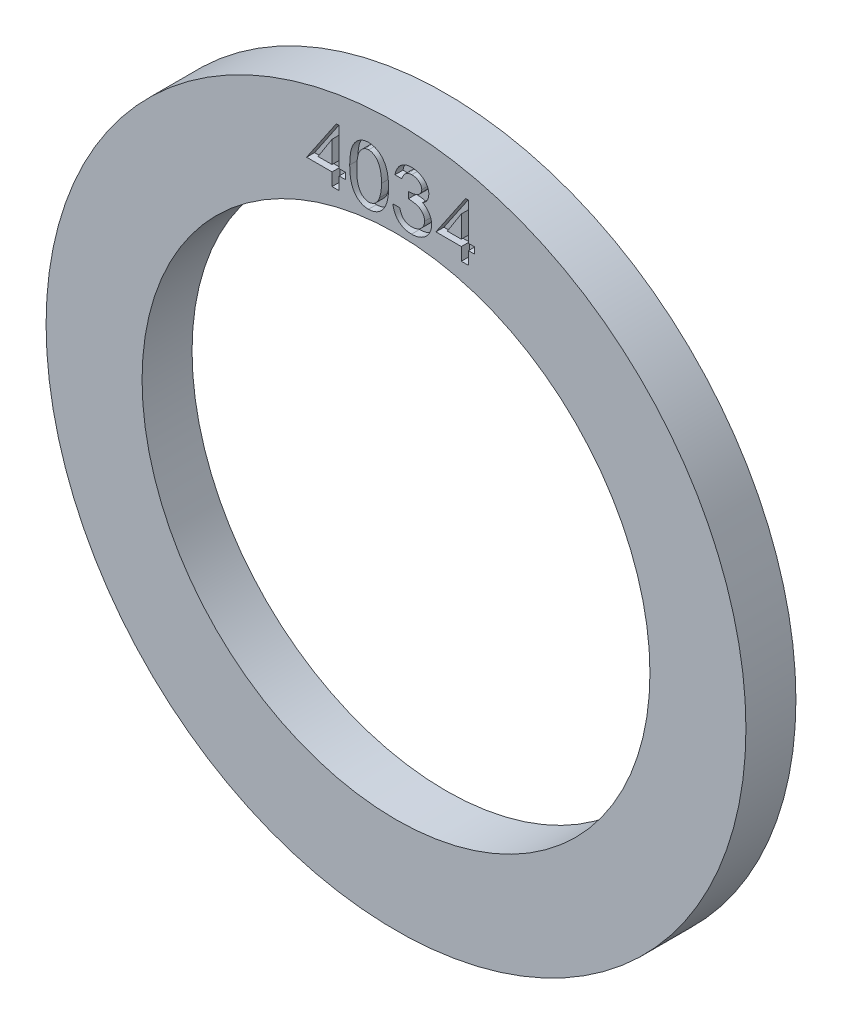
from build123d import *

# Parameters (mm, degrees)
SKETCH1_R           = 22.225
SKETCH1_R_2         = 16.129
BOSS_EXTRUDE1_DEPTH = 1.5875
CUT_EXTRUDE2_DEPTH  = 0.508


with BuildPart() as part:
    # Sketch1 → Boss-Extrude1 (new, symmetric)
    with BuildSketch(Plane.XY):
        Circle(SKETCH1_R)
        Circle(SKETCH1_R_2, mode=Mode.SUBTRACT)
    extrude(amount=BOSS_EXTRUDE1_DEPTH, both=True)

    # Sketch2 → Cut-Extrude2 (cut)
    # profile 1 of 4: a face of its own
    with BuildSketch(Plane.XY.offset(1.5875)):
        Polygon((-3.791509666, 20.251044915), (-3.614125852, 20.251044915), (-3.614125852, 17.872839787), (-3.210279698, 17.872839787), (-3.210279698, 17.468993633), (-3.614125852, 17.468993633), (-3.614125852, 16.661301325), (-4.0628438, 16.661301325), (-4.0628438, 17.468993633), (-5.678228416, 17.468993633), align=None)
        Polygon((-4.0628438, 17.872839787), (-4.0628438, 19.26456655), (-4.953969602, 17.872839787), align=None, mode=Mode.SUBTRACT)
    # profile 2 of 4: a face of its own
    with BuildSketch(Plane.XY.offset(1.5875)):
        with BuildLine():
            add(Edge.make_bspline(
                [(-2.941048928, 18.409899082), (-2.940714871, 18.465528296), (-2.940066118, 18.573562402), (-2.933075517, 18.730724356), (-2.921016214, 18.878244445), (-2.905526463, 19.016127046), (-2.884096804, 19.144466894), (-2.859576835, 19.263327408), (-2.829393503, 19.372723211), (-2.794138338, 19.472849511), (-2.754553878, 19.565484583), (-2.711030575, 19.651788768), (-2.663844085, 19.732857811), (-2.613313101, 19.808663476), (-2.55704867, 19.87751692), (-2.498353896, 19.941776173), (-2.435024929, 20.000186845), (-2.367642121, 20.052456508), (-2.297938231, 20.099713281), (-2.225089059, 20.13954444), (-2.150782552, 20.174241174), (-2.074071135, 20.202307821), (-1.995511001, 20.224110255), (-1.914820801, 20.239336109), (-1.832384226, 20.249821282), (-1.776518496, 20.250635629), (-1.748440755, 20.251044915)],
                knots=[0, 0, 0, 0, 1.622528522, 3.151013738, 4.587225782, 5.939257941, 7.196658267, 8.381214254, 9.47772444, 10.503964975, 11.475138444, 12.414102326, 13.321377868, 14.209997518, 15.068075989, 15.912287155, 16.746865696, 17.577313739, 18.397854368, 19.200328723, 19.996378645, 20.787862277, 21.580050128, 22.371504404, 23.181529048, 24, 24, 24, 24], degree=3))
            add(Edge.make_bspline(
                [(-1.748440755, 20.251044915), (-1.717811007, 20.250238313), (-1.657353324, 20.248646222), (-1.567631206, 20.239981971), (-1.480917261, 20.222477299), (-1.396021734, 20.20052576), (-1.314319719, 20.170517531), (-1.234192802, 20.136009443), (-1.158107244, 20.092301719), (-1.083467919, 20.044491407), (-1.01283399, 19.989356675), (-0.945275439, 19.929448929), (-0.882898589, 19.862723211), (-0.82342969, 19.791475538), (-0.769919155, 19.712915561), (-0.718978678, 19.629794111), (-0.673874137, 19.540041073), (-0.63107977, 19.445244175), (-0.594295467, 19.342882768), (-0.561002155, 19.23354141), (-0.534021567, 19.115857836), (-0.511640264, 18.990197781), (-0.494392293, 18.856349685), (-0.481654226, 18.714631492), (-0.475003729, 18.564910705), (-0.473746005, 18.462488899), (-0.473100211, 18.409899082)],
                knots=[0, 0, 0, 0, 0.875057392, 1.727207867, 2.570264412, 3.399251263, 4.229017074, 5.053828049, 5.887584622, 6.731829445, 7.583639997, 8.443960147, 9.308026848, 10.190032267, 11.091770676, 12.020167189, 12.972467704, 13.958579741, 14.989078804, 16.076606933, 17.221320015, 18.435081626, 19.720875061, 21.074561036, 22.497895074, 24, 24, 24, 24], degree=3))
            add(Edge.make_bspline(
                [(-0.473100211, 18.409899082), (-0.473752775, 18.357543781), (-0.475023532, 18.255590741), (-0.481578584, 18.106558771), (-0.494646805, 17.965611331), (-0.510737193, 17.832352817), (-0.533306544, 17.707187943), (-0.560787319, 17.590050585), (-0.591604786, 17.48032487), (-0.629277647, 17.37897245), (-0.670992422, 17.284287504), (-0.716250139, 17.195337012), (-0.766094257, 17.111945685), (-0.821284447, 17.035018306), (-0.87919086, 16.962134285), (-0.942329159, 16.895826742), (-1.009548672, 16.834831813), (-1.080686818, 16.779926292), (-1.15492935, 16.73041254), (-1.232742005, 16.68861695), (-1.312163306, 16.651519202), (-1.39496652, 16.623404593), (-1.479473143, 16.59941108), (-1.567106139, 16.583912552), (-1.65705202, 16.573651204), (-1.717796133, 16.572259721), (-1.748440755, 16.571557736)],
                knots=[0, 0, 0, 0, 1.496607488, 2.914388442, 4.262485651, 5.541812885, 6.749953981, 7.895567619, 8.980172623, 10.005210728, 10.983286874, 11.936336572, 12.856292636, 13.757107149, 14.640766483, 15.514956722, 16.370989637, 17.232841377, 18.081413197, 18.918442167, 19.755471137, 20.583656588, 21.41504191, 22.264086897, 23.124254193, 24, 24, 24, 24], degree=3))
            add(Edge.make_bspline(
                [(-1.748440755, 16.571557736), (-1.776743557, 16.572038655), (-1.832799275, 16.572991151), (-1.915574537, 16.582332898), (-1.99620952, 16.597836932), (-2.074467395, 16.619566497), (-2.150898016, 16.647154696), (-2.225169931, 16.680573941), (-2.29679497, 16.721040561), (-2.366456672, 16.766508212), (-2.433143309, 16.818224321), (-2.495257311, 16.87667647), (-2.554292102, 16.940467735), (-2.609078161, 17.010286023), (-2.660826184, 17.085680628), (-2.707476258, 17.167361865), (-2.750969263, 17.25445735), (-2.791292741, 17.34763793), (-2.82770104, 17.448522568), (-2.856739937, 17.559084985), (-2.884123335, 17.678118736), (-2.904218807, 17.806828007), (-2.921654227, 17.94424179), (-2.93176951, 18.091252119), (-2.940413799, 18.247371428), (-2.940833337, 18.354729926), (-2.941048928, 18.409899082)],
                knots=[0, 0, 0, 0, 0.82614074, 1.636230647, 2.42850654, 3.22151677, 4.005075515, 4.799112676, 5.596456327, 6.404618302, 7.226350817, 8.05679228, 8.892237205, 9.761873943, 10.645770802, 11.559890835, 12.505927976, 13.487073095, 14.523090282, 15.633895838, 16.822583925, 18.088023083, 19.435493537, 20.865857947, 22.389433785, 24, 24, 24, 24], degree=3))
        make_face()
        with BuildLine():
            add(Edge.make_bspline(
                [(-2.49233098, 18.411301325), (-2.492150749, 18.364320644), (-2.491801834, 18.27336956), (-2.486621012, 18.141759349), (-2.479244919, 18.01920969), (-2.468211472, 17.905753807), (-2.453498731, 17.801222999), (-2.436084743, 17.705761622), (-2.416230184, 17.619186789), (-2.392024141, 17.541356237), (-2.365221766, 17.470440471), (-2.335420975, 17.405153587), (-2.304477789, 17.344016498), (-2.269621234, 17.288240986), (-2.23270728, 17.237064839), (-2.193069368, 17.190682857), (-2.152122513, 17.148078367), (-2.093711058, 17.1007701), (-2.018868477, 17.051309357), (-1.925960318, 17.008419877), (-1.832352068, 16.980108587), (-1.769198203, 16.976962069), (-1.737923928, 16.975403889)],
                knots=[0, 0, 0, 0, 1.564601651, 3.028951736, 4.386019676, 5.653114642, 6.824348509, 7.900668805, 8.88431448, 9.780488761, 10.613163047, 11.407444027, 12.169849642, 12.89344098, 13.595615509, 14.26934431, 14.924332585, 15.560171042, 16.769153194, 17.901006317, 18.960562374, 20, 20, 20, 20], degree=3))
            add(Edge.make_bspline(
                [(-1.737923928, 16.975403889), (-1.70248388, 16.977258236), (-1.631824331, 16.980955389), (-1.527759812, 17.007875335), (-1.427979072, 17.053056674), (-1.348917371, 17.104101373), (-1.289183063, 17.153748574), (-1.246044066, 17.19601321), (-1.206282339, 17.24319876), (-1.168745971, 17.294586703), (-1.134805544, 17.351017673), (-1.102079163, 17.411210898), (-1.073584619, 17.47661051), (-1.057116286, 17.522183905), (-1.048721204, 17.545415909)],
                knots=[0, 0, 0, 0, 1.331887272, 2.655486065, 4.012646414, 5.436183829, 6.178803566, 6.930724497, 7.703763371, 8.496530827, 9.320959298, 10.178042319, 11.071218497, 12, 12, 12, 12], degree=3))
            add(Edge.make_bspline(
                [(-1.048721204, 17.545415909), (-1.038607067, 17.575939463), (-1.017988698, 17.638163845), (-0.992156716, 17.735043081), (-0.970771015, 17.836698519), (-0.952356735, 17.942588787), (-0.938374744, 18.053247356), (-0.928710251, 18.168567637), (-0.923166559, 18.288550341), (-0.922272622, 18.369929509), (-0.921818159, 18.411301325)],
                knots=[0, 0, 0, 0, 0.877617242, 1.789083553, 2.735016418, 3.71249782, 4.722174671, 5.778575778, 6.870664861, 8, 8, 8, 8], degree=3))
            add(Edge.make_bspline(
                [(-0.921818159, 18.411301325), (-0.921926931, 18.452677378), (-0.922139056, 18.533367608), (-0.928443607, 18.651397672), (-0.93606829, 18.763746542), (-0.94922228, 18.870045257), (-0.963943656, 18.970824302), (-0.984136214, 19.065371168), (-1.005793892, 19.154629724), (-1.032850639, 19.237497541), (-1.062431735, 19.314810507), (-1.093631295, 19.386825965), (-1.127365756, 19.45360154), (-1.164533159, 19.514299371), (-1.20376186, 19.569920711), (-1.245198218, 19.620131048), (-1.289459668, 19.664647761), (-1.351338681, 19.714841306), (-1.431108496, 19.767081899), (-1.530853987, 19.813965079), (-1.633851191, 19.841604125), (-1.703414086, 19.845343616), (-1.737923928, 19.847198761)],
                knots=[0, 0, 0, 0, 1.353201578, 2.638969622, 3.865559904, 5.035676431, 6.141732754, 7.195734042, 8.19695873, 9.144657206, 10.044788335, 10.904062871, 11.710933862, 12.489720227, 13.229995877, 13.935715626, 14.616825307, 15.279494989, 16.538995736, 17.725922936, 18.871840505, 20, 20, 20, 20], degree=3))
            add(Edge.make_bspline(
                [(-1.737923928, 19.847198761), (-1.769189184, 19.845610137), (-1.832550213, 19.842390687), (-1.926300527, 19.814472593), (-2.018874227, 19.771243042), (-2.093215286, 19.721748064), (-2.151143674, 19.674489969), (-2.192649545, 19.632854515), (-2.23099575, 19.586210446), (-2.268001168, 19.535446233), (-2.30179123, 19.479303868), (-2.334610323, 19.418807498), (-2.363526231, 19.352957617), (-2.390719967, 19.28198752), (-2.414671052, 19.204014725), (-2.435383748, 19.117572024), (-2.453893046, 19.022216196), (-2.467232636, 18.91747443), (-2.478446349, 18.803846185), (-2.486838605, 18.68110446), (-2.491738662, 18.549229551), (-2.492129231, 18.458280801), (-2.49233098, 18.411301325)],
                knots=[0, 0, 0, 0, 1.039778295, 2.107176824, 3.232337611, 4.43520669, 5.071253539, 5.720927637, 6.389866065, 7.081397607, 7.811854436, 8.571243718, 9.372887587, 10.205834777, 11.102302774, 12.088086757, 13.166194718, 14.33675119, 15.604261439, 16.970055543, 18.43488556, 20, 20, 20, 20], degree=3))
        make_face(mode=Mode.SUBTRACT)
    # profile 3 of 4: a face of its own
    with BuildSketch(Plane.XY.offset(1.5875)):
        with BuildLine():
            Line((0.361234725, 19.308737223), (-0.069254057, 19.308737223))
            add(Edge.make_bspline(
                [(-0.069254057, 19.308737223), (-0.060477528, 19.347450248), (-0.043297623, 19.423230336), (-0.008569206, 19.531484976), (0.030561657, 19.632724536), (0.075770246, 19.726175317), (0.128157748, 19.81110866), (0.184869566, 19.889163674), (0.248341236, 19.958712584), (0.317179118, 20.020717482), (0.391035687, 20.074280584), (0.467725405, 20.121796752), (0.547859073, 20.161635857), (0.630932405, 20.195015037), (0.717372097, 20.220279706), (0.807106397, 20.237344533), (0.899608373, 20.249332326), (0.962524291, 20.250469648), (0.994347706, 20.251044915)],
                knots=[0, 0, 0, 0, 1.225194122, 2.398296627, 3.506547767, 4.574817873, 5.598350885, 6.584148364, 7.54966307, 8.500147383, 9.439776218, 10.36307994, 11.282851771, 12.199447467, 13.124300948, 14.058371117, 15.017907346, 16, 16, 16, 16], degree=3))
            add(Edge.make_bspline(
                [(0.994347706, 20.251044915), (1.043754122, 20.249381138), (1.141547626, 20.246087909), (1.285610616, 20.221203717), (1.424016067, 20.178489126), (1.555476324, 20.120747977), (1.676959164, 20.050049015), (1.784401853, 19.967569377), (1.87680447, 19.875359147), (1.951495973, 19.773309266), (2.010642416, 19.666224553), (2.052901927, 19.556293212), (2.079775519, 19.44463821), (2.082988654, 19.369413478), (2.084592097, 19.331874242)],
                knots=[0, 0, 0, 0, 1.126551995, 2.229861531, 3.322496069, 4.422827045, 5.497949776, 6.520418829, 7.504194933, 8.464779191, 9.395175895, 10.286118409, 11.144725379, 12, 12, 12, 12], degree=3))
            add(Edge.make_bspline(
                [(2.084592097, 19.331874242), (2.083445369, 19.295561269), (2.08120203, 19.224522335), (2.061695754, 19.121253034), (2.030330643, 19.024376335), (1.985462342, 18.934294389), (1.928282318, 18.850826814), (1.857736159, 18.774694477), (1.775216924, 18.704509986), (1.71282851, 18.665061064), (1.680745943, 18.644774883)],
                knots=[0, 0, 0, 0, 1.039530957, 2.033630564, 2.999111873, 3.948297759, 4.906578666, 5.887513816, 6.913676835, 8, 8, 8, 8], degree=3))
            add(Edge.make_bspline(
                [(1.680745943, 18.644774883), (1.715412455, 18.629921932), (1.784584735, 18.600284901), (1.878737568, 18.537101706), (1.965290015, 18.461696904), (2.013689008, 18.401811555), (2.038318059, 18.371337383)],
                knots=[0, 0, 0, 0, 0.990740455, 1.976887035, 2.970487876, 4, 4, 4, 4], degree=3))
            add(Edge.make_bspline(
                [(2.038318059, 18.371337383), (2.056164651, 18.346551879), (2.091414901, 18.297596022), (2.138176314, 18.221132121), (2.176186574, 18.142282921), (2.209216335, 18.063037825), (2.233608595, 17.981914129), (2.251184988, 17.899620402), (2.26208307, 17.815873939), (2.26341174, 17.759523954), (2.264079277, 17.731213184)],
                knots=[0, 0, 0, 0, 1.060434252, 2.094549648, 3.107169572, 4.097295716, 5.072846837, 6.043796276, 7.017184609, 8, 8, 8, 8], degree=3))
            add(Edge.make_bspline(
                [(2.264079277, 17.731213184), (2.262318232, 17.682429547), (2.258786023, 17.584581893), (2.225855763, 17.439701952), (2.1754298, 17.296982475), (2.116395525, 17.182595766), (2.0608144, 17.093897839), (2.013941979, 17.030591865), (1.963481943, 16.97050347), (1.908107932, 16.915057497), (1.849578507, 16.862260416), (1.786022715, 16.813886876), (1.718562407, 16.768970844), (1.647523547, 16.727672296), (1.572817771, 16.69140718), (1.496065478, 16.658792234), (1.416340253, 16.63263796), (1.335130734, 16.609594189), (1.251082718, 16.593304478), (1.165069084, 16.580215877), (1.076483218, 16.573537601), (1.016792283, 16.572222266), (0.986635366, 16.571557736)],
                knots=[0, 0, 0, 0, 1.521749033, 3.052244174, 4.617626532, 6.240122497, 7.060311358, 7.885196768, 8.698339091, 9.508724546, 10.330730427, 11.158549718, 12.000758621, 12.860902525, 13.722748307, 14.593084173, 15.463328201, 16.341708233, 17.227848997, 18.135261118, 19.057900949, 20, 20, 20, 20], degree=3))
            add(Edge.make_bspline(
                [(0.986635366, 16.571557736), (0.948511945, 16.572408799), (0.873478779, 16.574083832), (0.763465407, 16.585984854), (0.658130748, 16.606319591), (0.557811678, 16.635197798), (0.461854285, 16.67150042), (0.371203286, 16.716729894), (0.285115181, 16.769457292), (0.204020013, 16.830633068), (0.129018426, 16.900841018), (0.060210273, 16.979971068), (-0.00056157, 17.069074246), (-0.055495698, 17.166783662), (-0.103090215, 17.274214986), (-0.144145964, 17.3905035), (-0.178964742, 17.516028797), (-0.19540515, 17.603464711), (-0.203869441, 17.648480813)],
                knots=[0, 0, 0, 0, 1.031951552, 2.031050468, 2.99141865, 3.932589319, 4.853771667, 5.764839348, 6.670884665, 7.583203617, 8.509779947, 9.447179227, 10.415909331, 11.424319639, 12.477825485, 13.592421652, 14.760465984, 16, 16, 16, 16], degree=3))
            Line((-0.203869441, 17.648480813), (0.231527193, 17.648480813))
            add(Edge.make_bspline(
                [(0.231527193, 17.648480813), (0.240205272, 17.618738917), (0.256832813, 17.561752274), (0.284091528, 17.480365198), (0.313415167, 17.407229405), (0.343629879, 17.341362502), (0.374887687, 17.28302967), (0.40786601, 17.232325014), (0.441887234, 17.188774427), (0.467501123, 17.164887763), (0.479724309, 17.153488825)],
                knots=[0, 0, 0, 0, 1.326285875, 2.54121601, 3.672658499, 4.697761427, 5.642367002, 6.502616728, 7.285434817, 8, 8, 8, 8], degree=3))
            add(Edge.make_bspline(
                [(0.479724309, 17.153488825), (0.497417686, 17.139046079), (0.532460374, 17.110441442), (0.590166132, 17.075070446), (0.64967425, 17.04340537), (0.713110557, 17.019578261), (0.778550216, 16.99943862), (0.847105035, 16.985550394), (0.918406685, 16.976979729), (0.966979485, 16.975933153), (0.991543219, 16.975403889)],
                knots=[0, 0, 0, 0, 0.989076215, 1.958918776, 2.928708407, 3.907140108, 4.891221483, 5.894723991, 6.935341563, 8, 8, 8, 8], degree=3))
            add(Edge.make_bspline(
                [(0.991543219, 16.975403889), (1.021948819, 16.97612172), (1.081519382, 16.97752809), (1.168376235, 16.987190175), (1.250734278, 17.004186285), (1.32823134, 17.027814749), (1.401380997, 17.058160724), (1.469417239, 17.095466572), (1.533146353, 17.13904902), (1.590999837, 17.189621633), (1.642834447, 17.244507797), (1.689057427, 17.301773691), (1.72855632, 17.361137372), (1.760199264, 17.423362992), (1.78513107, 17.487684017), (1.802392661, 17.554279216), (1.813457985, 17.623105453), (1.814720606, 17.669705325), (1.815361328, 17.693352607)],
                knots=[0, 0, 0, 0, 1.196856166, 2.344877135, 3.434653565, 4.502660904, 5.529498559, 6.546397239, 7.551828815, 8.562675341, 9.564818567, 10.520268272, 11.456705045, 12.365995596, 13.262962725, 14.166698094, 15.069683942, 16, 16, 16, 16], degree=3))
            add(Edge.make_bspline(
                [(1.815361328, 17.693352607), (1.813966757, 17.724546007), (1.811179497, 17.786890692), (1.790024052, 17.878564926), (1.756093736, 17.967470918), (1.708164483, 18.0515279), (1.649826431, 18.130274223), (1.579854053, 18.199250794), (1.500074695, 18.258184063), (1.425659717, 18.298928594), (1.358232027, 18.325854588), (1.299434784, 18.344589605), (1.23266437, 18.361230204), (1.158233054, 18.375808534), (1.075889991, 18.388351392), (0.985608604, 18.398705864), (0.887151903, 18.406967034), (0.818842685, 18.411201851), (0.783310046, 18.413404691)],
                knots=[0, 0, 0, 0, 1.058801672, 2.116173898, 3.179133807, 4.280986043, 5.392377071, 6.498225676, 7.604871823, 8.752253925, 9.368447799, 10.068883315, 10.846735517, 11.704571958, 12.644304815, 13.675272135, 14.790738352, 16, 16, 16, 16], degree=3))
            Line((0.783310046, 18.413404691), (0.783310046, 18.815147479))
            add(Edge.make_bspline(
                [(0.783310046, 18.815147479), (0.829627675, 18.815999682), (0.91854358, 18.817635654), (1.046196033, 18.832504747), (1.162372105, 18.856445728), (1.266507876, 18.890651428), (1.357342881, 18.932986126), (1.436138055, 18.978410855), (1.500487154, 19.030212286), (1.551175868, 19.086708252), (1.588435578, 19.147587812), (1.616681567, 19.209974418), (1.632325527, 19.275966616), (1.634684114, 19.320581554), (1.635874148, 19.343092191)],
                knots=[0, 0, 0, 0, 1.49683591, 2.87347434, 4.147795521, 5.325633569, 6.407353164, 7.383009189, 8.25851615, 9.066624807, 9.823413814, 10.557538392, 11.272200497, 12, 12, 12, 12], degree=3))
            add(Edge.make_bspline(
                [(1.635874148, 19.343092191), (1.635363954, 19.359724739), (1.634358357, 19.39250758), (1.625433365, 19.440957285), (1.611606195, 19.487849144), (1.591831437, 19.533091503), (1.565927657, 19.576275484), (1.535307572, 19.618384906), (1.49829813, 19.658456666), (1.456525145, 19.69664359), (1.410806559, 19.732198237), (1.361342049, 19.763368942), (1.308634959, 19.789261957), (1.252681297, 19.810312028), (1.193870495, 19.82720865), (1.131694434, 19.839060597), (1.066498999, 19.846192582), (1.021943591, 19.846859275), (0.999255559, 19.847198761)],
                knots=[0, 0, 0, 0, 0.88508993, 1.744517034, 2.61478088, 3.484243336, 4.365825862, 5.291885516, 6.252189795, 7.265246754, 8.303377192, 9.332440159, 10.373327524, 11.425096702, 12.51242353, 13.62794981, 14.792129802, 16, 16, 16, 16], degree=3))
            add(Edge.make_bspline(
                [(0.999255559, 19.847198761), (0.966677797, 19.84578941), (0.903013258, 19.84303521), (0.810483937, 19.823255151), (0.724578438, 19.788832291), (0.657593541, 19.749609123), (0.607269746, 19.709836894), (0.57031615, 19.672494944), (0.534398781, 19.628136294), (0.497783011, 19.577930143), (0.462669797, 19.520237865), (0.427956001, 19.456057046), (0.39337483, 19.385016897), (0.372210545, 19.33478667), (0.361234725, 19.308737223)],
                knots=[0, 0, 0, 0, 1.30644707, 2.553102055, 3.773430717, 5.004978473, 5.652102429, 6.34150733, 7.107309491, 7.939915375, 8.832283585, 9.813897121, 10.866284818, 12, 12, 12, 12], degree=3))
        make_face()
    # profile 4 of 4: a face of its own
    with BuildSketch(Plane.XY.offset(1.5875)):
        Polygon((4.420028796, 20.251044915), (4.59741261, 20.251044915), (4.59741261, 17.872839787), (5.001258764, 17.872839787), (5.001258764, 17.468993633), (4.59741261, 17.468993633), (4.59741261, 16.661301325), (4.148694661, 16.661301325), (4.148694661, 17.468993633), (2.533310046, 17.468993633), align=None)
        Polygon((4.148694661, 17.872839787), (4.148694661, 19.26456655), (3.25756886, 17.872839787), align=None, mode=Mode.SUBTRACT)
    extrude(amount=-CUT_EXTRUDE2_DEPTH, mode=Mode.SUBTRACT)


solid = part.part
